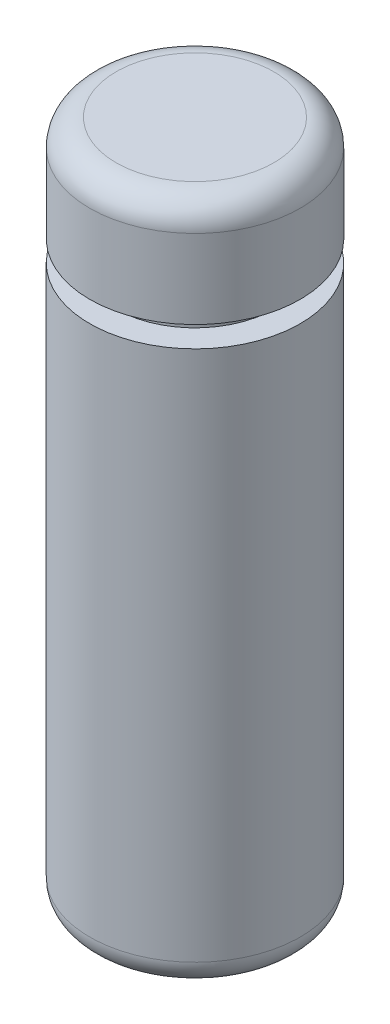
from build123d import *

# Parameters (mm, degrees)
ESQUISSE2_W = 4
ESQUISSE2_H = 26
CONG_2_R    = 1
ESQUISSE3_W = 1.417366919
ESQUISSE3_H = 0.8


with BuildPart() as part:
    # Esquisse2 → Révolution1 (revolve)
    with BuildSketch(Plane.XY, mode=Mode.PRIVATE) as r_volution1_sk:
        with Locations((2, 13)):
            Rectangle(ESQUISSE2_W, ESQUISSE2_H)
    revolve(r_volution1_sk.sketch.rotate(Axis((0, 0, 0), (0, 1, 0)), 90), axis=Axis((0, 0, 0), (0, 1, 0)))

    # Congé2
    cong_2_edges = [part.edges().sort_by_distance(p)[0] for p in [
        (0, 0, 4),
        (0, 26, 4),
    ]]
    fillet(cong_2_edges, radius=CONG_2_R)

    # Esquisse3 → Enlèvement de matière-Révolution1 (revolve, cut)
    with BuildSketch(Plane.XY, mode=Mode.PRIVATE) as enl_vement_de_mati_re_r_volution1_sk:
        with Locations((-3.731857201, 21.6)):
            Rectangle(ESQUISSE3_W, ESQUISSE3_H)
    revolve(enl_vement_de_mati_re_r_volution1_sk.sketch.rotate(Axis((0, 0, 0), (0, -1, 0)), 270), axis=Axis((0, 0, 0), (0, -1, 0)), mode=Mode.SUBTRACT)


solid = part.part
